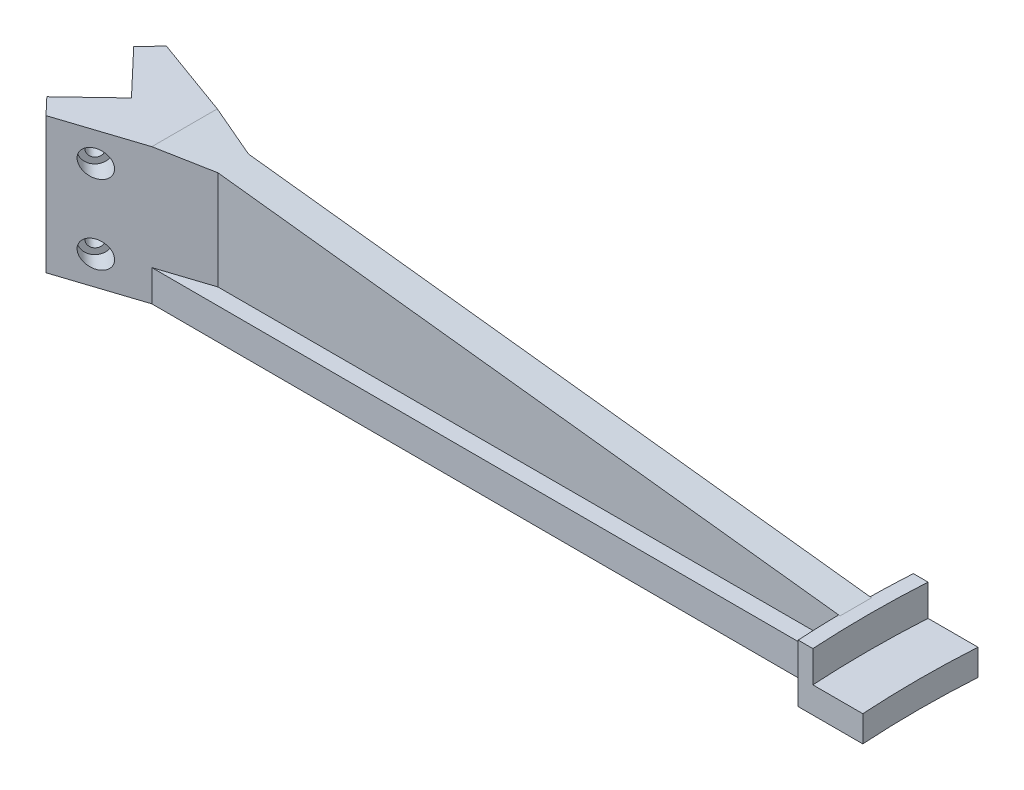
from build123d import *

# Parameters (mm, degrees)
BOSS_EXTRUDE2_DEPTH          = 12
BOSS_EXTRUDE3_START          = -2
BOSS_EXTRUDE3_DEPTH          = 10
BOSS_EXTRUDE4_START          = 10
BOSS_EXTRUDE4_DEPTH          = 22
BOSS_EXTRUDE7_DEPTH          = 40
BOSS_EXTRUDE17_DEPTH         = 6
BOSS_EXTRUDE17_DEPTH_BACK    = 6
CUT_EXTRUDE_THIN1_DEPTH      = 297.279628574
CUT_EXTRUDE_THIN1_DEPTH_BACK = 297.279628574
CUT_EXTRUDE1_START           = -8
SKETCH6_R                    = 5
CUT_EXTRUDE1_DEPTH           = 231.29743947
SKETCH6_4_R                  = 2.75
CUT_EXTRUDE2_DEPTH           = 239.29743947


with BuildPart() as part:
    # Sketch2 → Boss-Extrude2 (new body)
    with BuildSketch(Plane(origin=(0, 0, 0), x_dir=(1, 0, 0), z_dir=(0, 1, 0))):
        with BuildLine():
            Line((-292.596610314, 15.743442535), (-276.02456554, 0))
            Line((-276.02456554, 0), (-292.596610314, -17.444257657))
            Line((-292.596610314, -17.444257657), (-286.510767905, -23.850407561))
            Line((-286.510767905, -23.850407561), (-256.02456554, -12.789688675))
            Line((-256.02456554, -12.789688675), (0.21086679, -12.5))
            ThreePointArc((0.21086679, -12.5), (0.401744327, -17.25142014), (0.653571446, -22))
            Line((0.653571446, -22), (6.263616969, -22))
            ThreePointArc((6.263616969, -22), (5.6, 0), (6.263616969, 22))
            Line((6.263616969, 22), (0.653571446, 22))
            ThreePointArc((0.653571446, 22), (0.401744327, 17.25142014), (0.21086679, 12.5))
            Line((0.21086679, 12.5), (-256.02456554, 12.210311325))
            Line((-256.02456554, 12.210311325), (-286.510767905, 22.149592439))
            Line((-286.510767905, 22.149592439), (-292.596610314, 15.743442535))
        make_face()
    extrude(amount=-BOSS_EXTRUDE2_DEPTH)

    # Sketch2<5> → Boss-Extrude3 (add)
    with BuildSketch(Plane(origin=(0, 0, 0), x_dir=(1, 0, 0), z_dir=(0, 1, 0)).offset(BOSS_EXTRUDE3_START)):
        with BuildLine():
            Line((25.340211435, 22), (6.263616969, 22))
            ThreePointArc((6.263616969, 22), (5.6, 0), (6.263616969, -22))
            Line((6.263616969, -22), (25.340211435, -22))
            ThreePointArc((25.340211435, -22), (24.64, 0), (25.340211435, 22))
        make_face()
    extrude(amount=-BOSS_EXTRUDE3_DEPTH)

    # Sketch2<6> → Boss-Extrude4 (add)
    with BuildSketch(Plane(origin=(0, 0, 0), x_dir=(1, 0, 0), z_dir=(0, 1, 0)).offset(BOSS_EXTRUDE4_START)):
        with BuildLine():
            ThreePointArc((0.653571446, 22), (0.401744327, 17.25142014), (0.21086679, 12.5))
            ThreePointArc((0.21086679, 12.5), (0, 0), (0.21086679, -12.5))
            ThreePointArc((0.21086679, -12.5), (0.401744327, -17.25142014), (0.653571446, -22))
            Line((0.653571446, -22), (6.263616969, -22))
            ThreePointArc((6.263616969, -22), (5.6, 0), (6.263616969, 22))
            Line((6.263616969, 22), (0.653571446, 22))
        make_face()
    extrude(amount=-BOSS_EXTRUDE4_DEPTH)

    # Sketch2<9> → Boss-Extrude7 (add)
    with BuildSketch(Plane(origin=(0, 0, 0), x_dir=(1, 0, 0), z_dir=(0, 1, 0))):
        Polygon((-292.596610314, 15.743442535), (-276.02456554, 0), (-292.596610314, -17.444257657), (-286.510767905, -23.850407561), (-219.731467486, 0.377833809), (-286.510767905, 22.149592439), align=None)
    extrude(amount=BOSS_EXTRUDE7_DEPTH)

    # Sketch4 → Boss-Extrude17 (add, two sides: drawn at the far end of the back side and taken through both)
    with BuildSketch(Plane.XY.offset(-BOSS_EXTRUDE17_DEPTH_BACK)):
        Polygon((0.653571446, 10), (-256.02456554, 40), (-256.02456554, 0), (0.653571446, 0), align=None)
    extrude(amount=BOSS_EXTRUDE17_DEPTH + BOSS_EXTRUDE17_DEPTH_BACK)

    # Sketch5 → Cut-Extrude-Thin1 (cut, two sides: drawn at the far end of the back side and taken through both)
    with BuildSketch(Plane.XY.offset(-CUT_EXTRUDE_THIN1_DEPTH_BACK)):
        Polygon((0.653571446, 10), (-256.02456554, 40), (-254.863688753, 49.932389697), (1.814448233, 19.932389697), align=None)
    extrude(amount=CUT_EXTRUDE_THIN1_DEPTH + CUT_EXTRUDE_THIN1_DEPTH_BACK, mode=Mode.SUBTRACT)

    # Sketch6 → Cut-Extrude1 (cut, through all)
    with BuildSketch(Plane(origin=(-145.085185566, 0, -137.830926288), x_dir=(-0.6887494619146907, 0, 0.724999433594416), z_dir=(-0.724999433594416, 0, -0.6887494619146907)).offset(CUT_EXTRUDE1_START)):
        with Locations((200.111770991, 29)):
            Circle(SKETCH6_R)
        with Locations((200.111770991, -1)):
            Circle(SKETCH6_R)
    cut_extrude1 = extrude(amount=-CUT_EXTRUDE1_DEPTH, mode=Mode.SUBTRACT)

    # Sketch6<4> → Cut-Extrude2 (cut, symmetric)
    with BuildSketch(Plane(origin=(-145.085185566, 0, -137.830926288), x_dir=(-0.6887494619146907, 0, 0.724999433594416), z_dir=(-0.724999433594416, 0, -0.6887494619146907))):
        with Locations((200.111770991, 29)):
            Circle(SKETCH6_4_R)
        with Locations((200.111770991, -1)):
            Circle(SKETCH6_4_R)
    cut_extrude2 = extrude(amount=CUT_EXTRUDE2_DEPTH, both=True, mode=Mode.SUBTRACT)

    # Mirror1: Cut-Extrude1, Cut-Extrude2 across plane
    add(cut_extrude1.mirror(Plane.XY), mode=Mode.SUBTRACT)
    add(cut_extrude2.mirror(Plane.XY), mode=Mode.SUBTRACT)


with BuildPart() as body_2:
    # Mirror4: mirrored copy
    add(part.part.mirror(Plane.XY.offset(-40)))


solid = body_2.part
